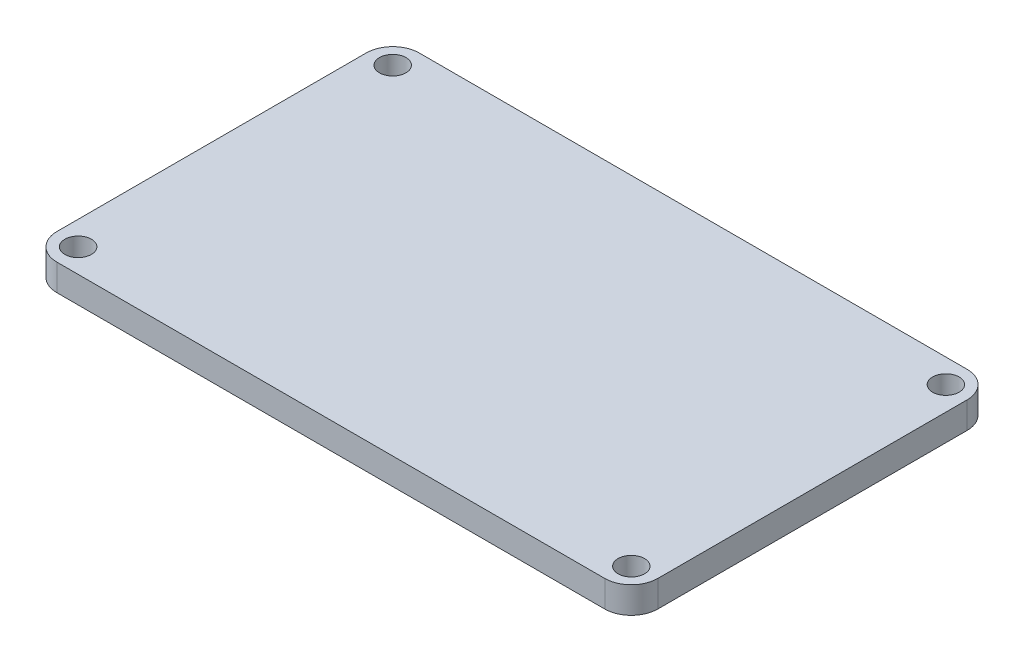
from build123d import *

# Parameters (mm, degrees)
SKETCH_1_W          = 68
SKETCH_1_H          = 41
EXTRUDE_1_DEPTH     = 3
SKETCH_2_R          = 1.5
CUT_EXTRUDE_1_DEPTH = 3
FILLET_1_R          = 3
FILLET_2_R          = 3
FILLET_3_R          = 3
FILLET_4_R          = 3


with BuildPart() as part:
    # 草图1 → 凸台-拉伸1 (new body)
    with BuildSketch(Plane(origin=(0, 0, 0), x_dir=(1, 0, 0), z_dir=(0, 1, 0))):
        Rectangle(SKETCH_1_W, SKETCH_1_H)
    extrude(amount=EXTRUDE_1_DEPTH)

    # 草图2 → 切除-拉伸1 (cut)
    with BuildSketch(Plane(origin=(0, 3, 0), x_dir=(1, 0, 0), z_dir=(0, 1, 0))):
        with Locations(Location((31.3, 17.8, 0), (0, 0, 270))):
            Circle(SKETCH_2_R)
        with Locations(Location((-31.3, -17.8, 0), (0, 0, 270))):
            Circle(SKETCH_2_R)
        with Locations(Location((31.3, -17.8, 0), (0, 0, 270))):
            Circle(SKETCH_2_R)
        with Locations(Location((-31.3, 17.8, 0), (0, 0, 270))):
            Circle(SKETCH_2_R)
    extrude(amount=-CUT_EXTRUDE_1_DEPTH, mode=Mode.SUBTRACT)

    # 圆角1
    fillet_1_edges = [part.edges().sort_by_distance(p)[0] for p in [
        (-34, 1.5, -20.5),
    ]]
    fillet(fillet_1_edges, radius=FILLET_1_R)

    # 圆角2
    fillet_2_edges = [part.edges().sort_by_distance(p)[0] for p in [
        (34, 1.5, -20.5),
    ]]
    fillet(fillet_2_edges, radius=FILLET_2_R)

    # 圆角3
    fillet_3_edges = [part.edges().sort_by_distance(p)[0] for p in [
        (-34, 1.5, 20.5),
    ]]
    fillet(fillet_3_edges, radius=FILLET_3_R)

    # 圆角4
    fillet_4_edges = [part.edges().sort_by_distance(p)[0] for p in [
        (34, 1.5, 20.5),
    ]]
    fillet(fillet_4_edges, radius=FILLET_4_R)


solid = part.part
